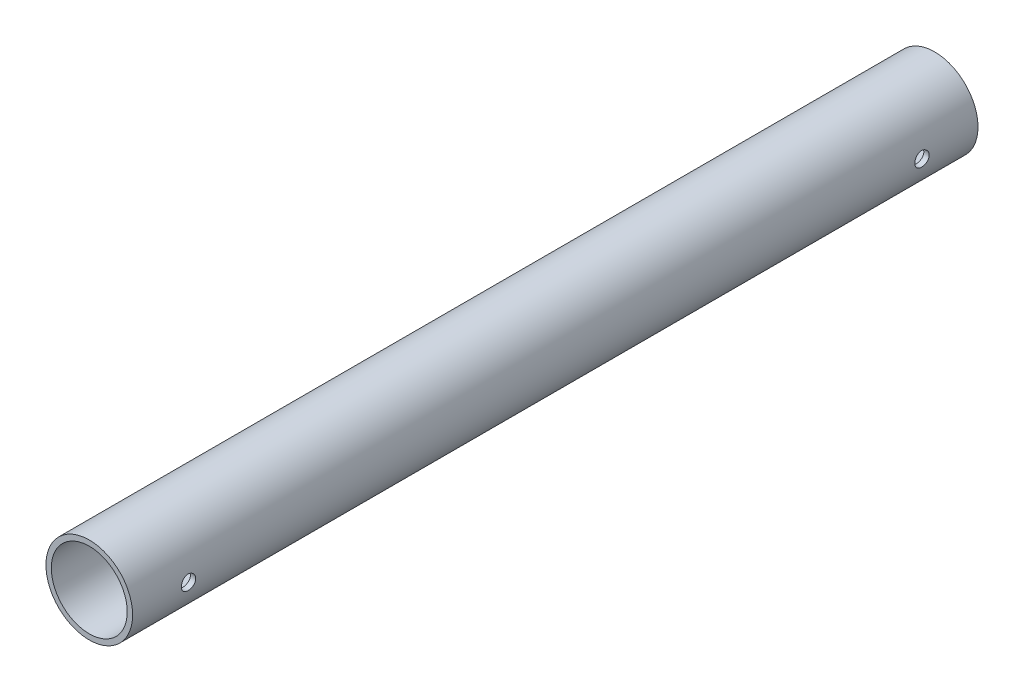
from build123d import *

# Parameters (mm, degrees)
SKETCH1_R           = 12.1
SKETCH1_R_2         = 10.6
BOSS_EXTRUDE1_DEPTH = 118
SKETCH2_R           = 2
CUT_EXTRUDE1_DEPTH  = 120.234307144


with BuildPart() as part:
    # Sketch1 → Boss-Extrude1 (new body)
    with BuildSketch(Plane.XY):
        Circle(SKETCH1_R)
        Circle(SKETCH1_R_2, mode=Mode.SUBTRACT)
    boss_extrude1 = extrude(amount=BOSS_EXTRUDE1_DEPTH)

    # Sketch2 → Cut-Extrude1 (cut, symmetric)
    with BuildSketch(Plane(origin=(0, 0, 0), x_dir=(0, 0, -1), z_dir=(1, 0, 0))):
        with Locations((-102.375, 0)):
            Circle(SKETCH2_R)
    cut_extrude1 = extrude(amount=CUT_EXTRUDE1_DEPTH, both=True, mode=Mode.SUBTRACT)

    # Mirror1: Boss-Extrude1, Cut-Extrude1 across plane
    add(boss_extrude1.mirror(Plane.XY))
    add(cut_extrude1.mirror(Plane.XY), mode=Mode.SUBTRACT)


solid = part.part
